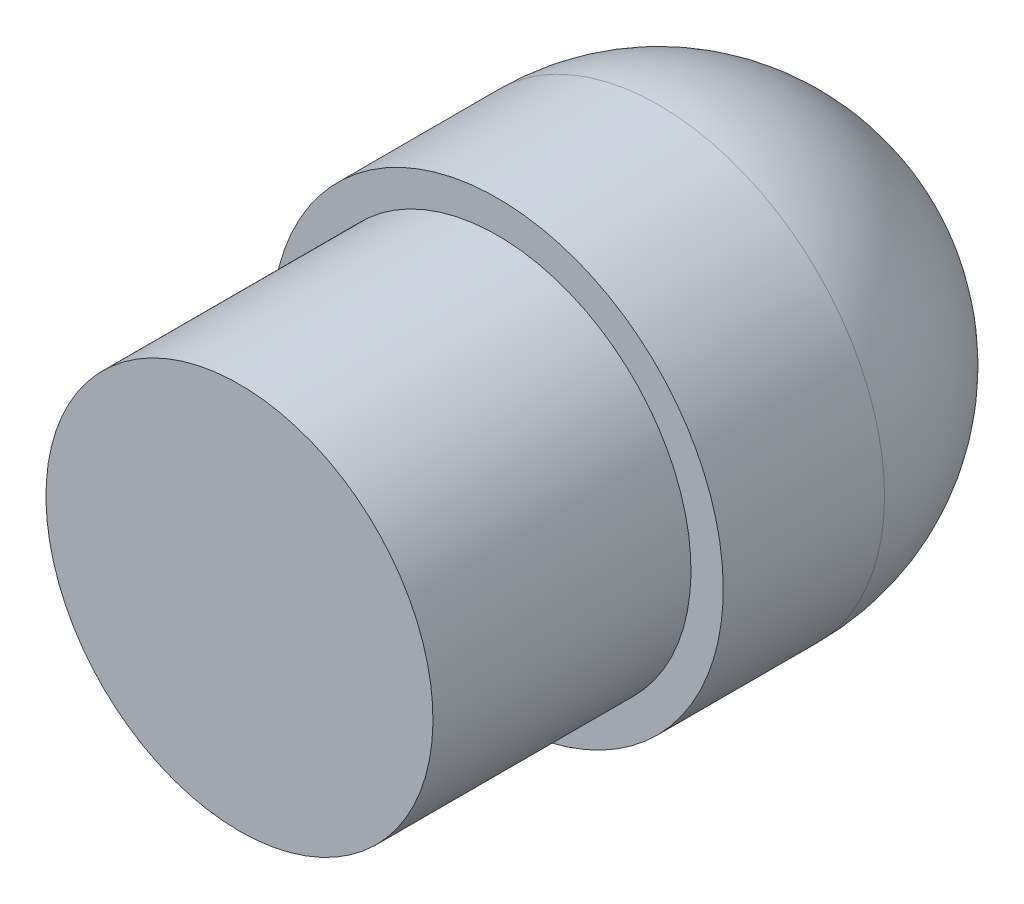
from build123d import *


with BuildPart() as part:
    # Sketch1 → Revolve1 (revolve)
    with BuildSketch(Plane(origin=(0, 0, 0), x_dir=(0, 0, -1), z_dir=(1, 0, 0)), mode=Mode.PRIVATE) as revolve1_sk:
        with BuildLine():
            Line((-25, 0), (-25, 15))
            Line((-25, 15), (-5, 15))
            Line((-5, 15), (-5, 17.5))
            Line((-5, 17.5), (7.5, 17.5))
            ThreePointArc((7.5, 17.5), (19.874368671, 12.374368671), (25, 0))
            Line((25, 0), (-25, 0))
        make_face()
    revolve(revolve1_sk.sketch.rotate(Axis((0, 0, 25), (0, 0, -1)), 180), axis=Axis((0, 0, 25), (0, 0, -1)))


solid = part.part
